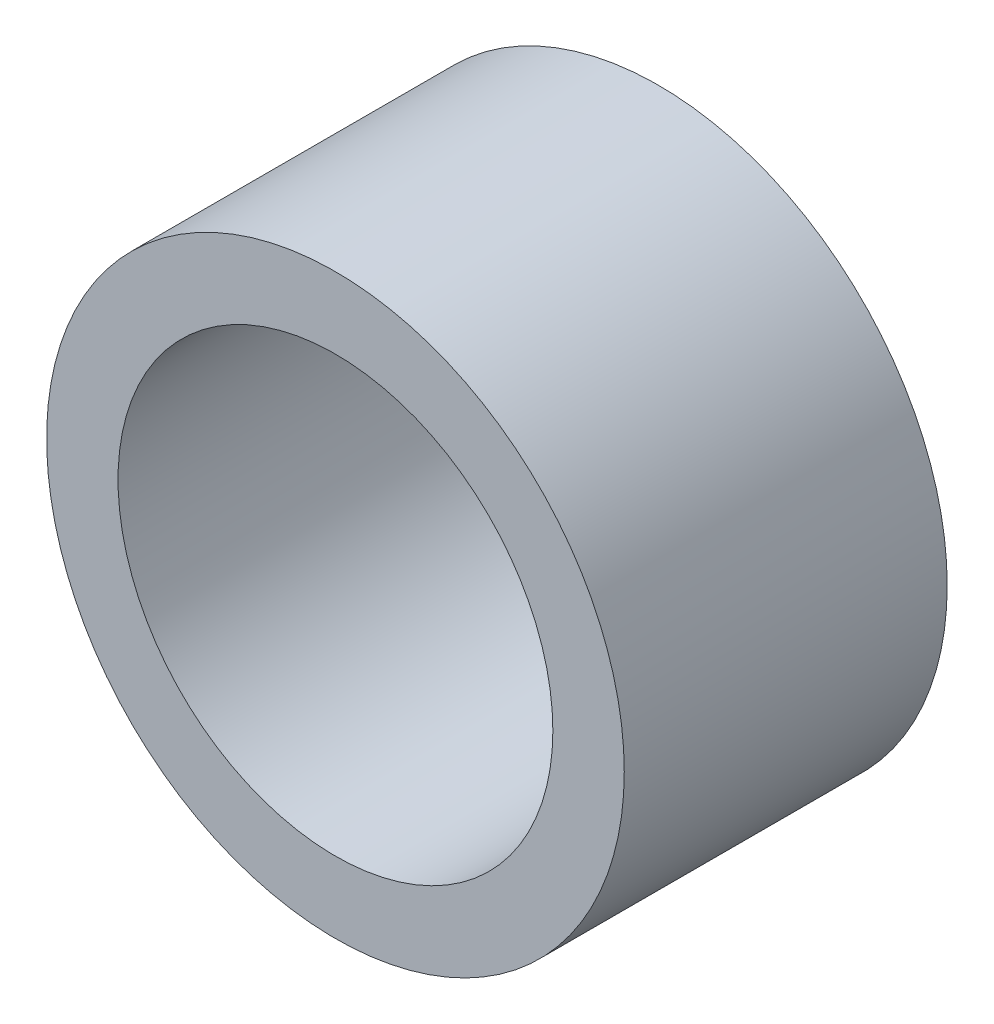
from build123d import *

# Parameters (mm, degrees)
SKETCH1_R           = 12.7
SKETCH1_R_2         = 9.56
BOSS_EXTRUDE1_DEPTH = 14.2


with BuildPart() as part:
    # Sketch1 → Boss-Extrude1 (new body)
    with BuildSketch(Plane.XY):
        Circle(SKETCH1_R)
        Circle(SKETCH1_R_2, mode=Mode.SUBTRACT)
    extrude(amount=BOSS_EXTRUDE1_DEPTH)


solid = part.part
